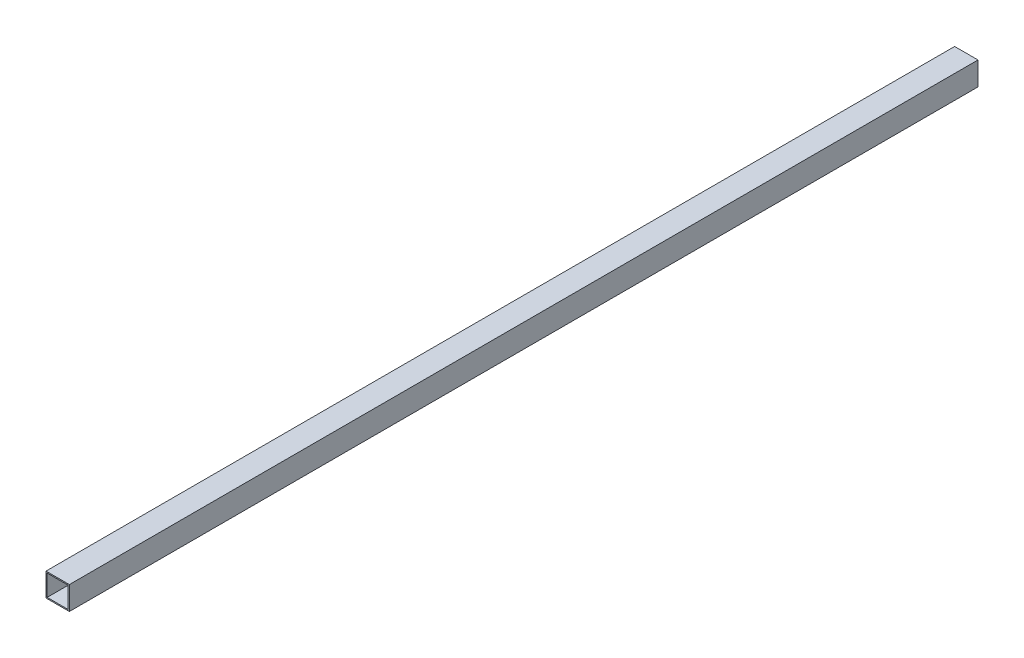
from build123d import *

# Parameters (mm, degrees)
SKETCH1_W           = 31.75
SKETCH1_H           = 31.75
SKETCH1_W_2         = 28.575
SKETCH1_H_2         = 28.575
BOSS_EXTRUDE1_DEPTH = 1235


with BuildPart() as part:
    # Sketch1 → Boss-Extrude1 (new body)
    with BuildSketch(Plane.XY):
        Rectangle(SKETCH1_W, SKETCH1_H)
        Rectangle(SKETCH1_W_2, SKETCH1_H_2, mode=Mode.SUBTRACT)
    extrude(amount=BOSS_EXTRUDE1_DEPTH)


solid = part.part
